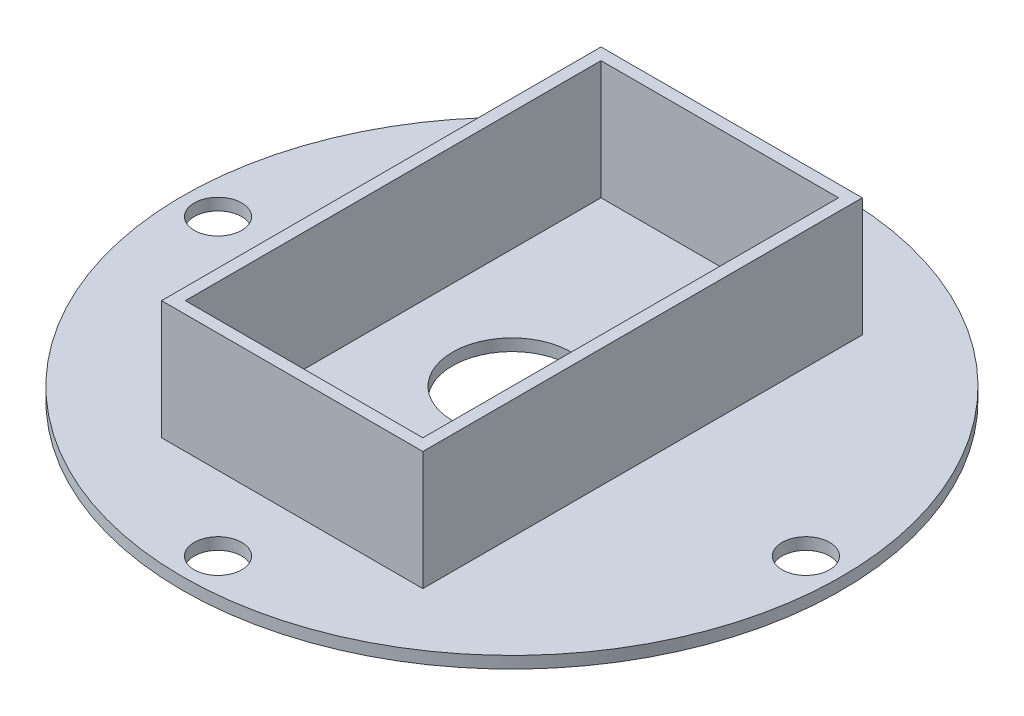
from build123d import *

# Parameters (mm, degrees)
SKETCH1_R           = 55.5
SKETCH1_R_2         = 4
BOSS_EXTRUDE4_DEPTH = 2
SKETCH6_W           = 44
SKETCH6_H           = 74
SKETCH6_W_2         = 40
SKETCH6_H_2         = 70
BOSS_EXTRUDE5_DEPTH = 20
SKETCH7_R           = 10
CUT_EXTRUDE2_DEPTH  = 30


with BuildPart() as part:
    # Sketch1 → Boss-Extrude4 (new body)
    with BuildSketch(Plane(origin=(0, 0, 0), x_dir=(1, 0, 0), z_dir=(0, 1, 0))):
        with Locations(Location((0, 0, 0), (0, 0, 270))):
            Circle(SKETCH1_R)
        with Locations(Location((0, 49.5, 0), (0, 0, 270))):
            Circle(SKETCH1_R_2, mode=Mode.SUBTRACT)
        with Locations(Location((49.5, 0, 0), (0, 0, 270))):
            Circle(SKETCH1_R_2, mode=Mode.SUBTRACT)
        with Locations(Location((-49.5, 0, 0), (0, 0, 270))):
            Circle(SKETCH1_R_2, mode=Mode.SUBTRACT)
        with Locations(Location((0, -49.5, 0), (0, 0, 270))):
            Circle(SKETCH1_R_2, mode=Mode.SUBTRACT)
    extrude(amount=BOSS_EXTRUDE4_DEPTH)

    # Sketch6 → Boss-Extrude5 (add)
    with BuildSketch(Plane(origin=(0, 2, 0), x_dir=(1, 0, 0), z_dir=(0, 1, 0))):
        Rectangle(SKETCH6_W, SKETCH6_H)
        Rectangle(SKETCH6_W_2, SKETCH6_H_2, mode=Mode.SUBTRACT)
    extrude(amount=BOSS_EXTRUDE5_DEPTH)

    # Sketch7 → Cut-Extrude2 (cut)
    with BuildSketch(Plane(origin=(0, 2, 0), x_dir=(1, 0, 0), z_dir=(0, 1, 0))):
        with Locations(Location((0, 0, 0), (0, 0, 270))):
            Circle(SKETCH7_R)
    extrude(amount=-CUT_EXTRUDE2_DEPTH, mode=Mode.SUBTRACT)


solid = part.part
